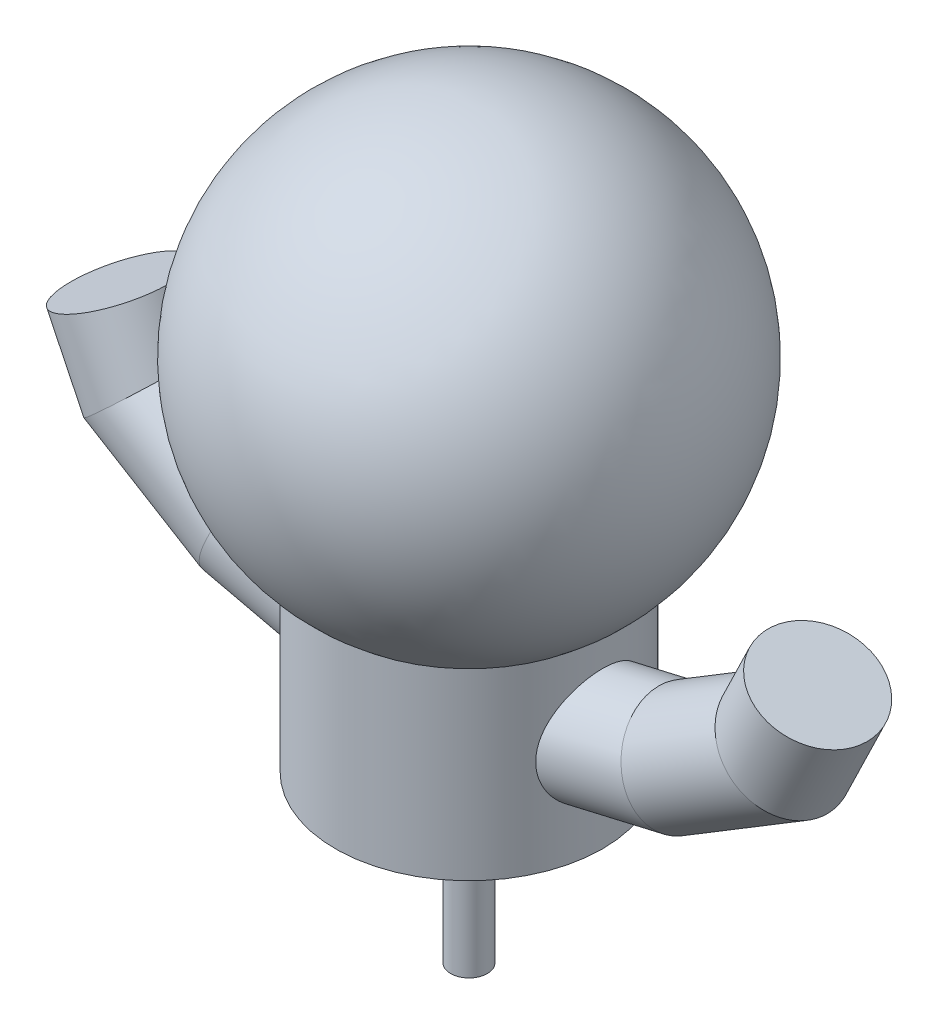
from build123d import *

# Parameters (mm, degrees)
SWEEP1_PROFILE_R = 1.5


with BuildPart() as part:
    # Esquisse1 → Révolution4 (revolve)
    with BuildSketch(Plane.XY):
        with BuildLine():
            Line((0, 5), (0, 6))
            ThreePointArc((0, 6), (5.684108375, 1.921174635), (3.640054945, -4.769696007))
            Line((3.640054945, -4.769696007), (3.640054945, -9.769696007))
            Line((3.640054945, -9.769696007), (0.5, -9.769696007))
            Line((0.5, -9.769696007), (0.5, -14.283094956))
            Line((0.5, -14.283094956), (0, -14.283094956))
            Line((0, -14.283094956), (0, -4.769696007))
            Line((0, -4.769696007), (1.5, -4.769696007))
            ThreePointArc((1.5, -4.769696007), (4.942088629, 0.758788496), (0, 5))
        make_face()
    revolve(axis=Axis((0, 0, 0), (0, 1, 0)))

    # Sweep1: sweep along a path in Sketch1
    with BuildLine(Plane.XY) as sweep1_path:
        Line((9.49641969, -2.980934088), (8.595599399, -4.835775301))
        Line((8.595599399, -4.835775301), (5.744918771, -6.566545682))
        Line((5.744918771, -6.566545682), (3.118220193, -7.177405817))
        Line((3.118220193, -7.177405817), (-3.118220193, -7.177405817))
        Line((-3.118220193, -7.177405817), (-5.744918771, -6.566545682))
        Line((-5.744918771, -6.566545682), (-8.595599399, -4.835775301))
        Line((-8.595599399, -4.835775301), (-9.49641969, -2.980934088))
    # Sweep1 profile (on start of the path) → Sweep1 (sweep)
    with BuildSketch(Plane(origin=(9.49641969, -2.980934088, 0), x_dir=(-0.8995277091216457, 0.4368637093217566, 0), z_dir=(-0.4368637093217566, -0.8995277091216457, 0))):
        Circle(SWEEP1_PROFILE_R)
    sweep(path=sweep1_path.line, transition=Transition.RIGHT)


solid = part.part
